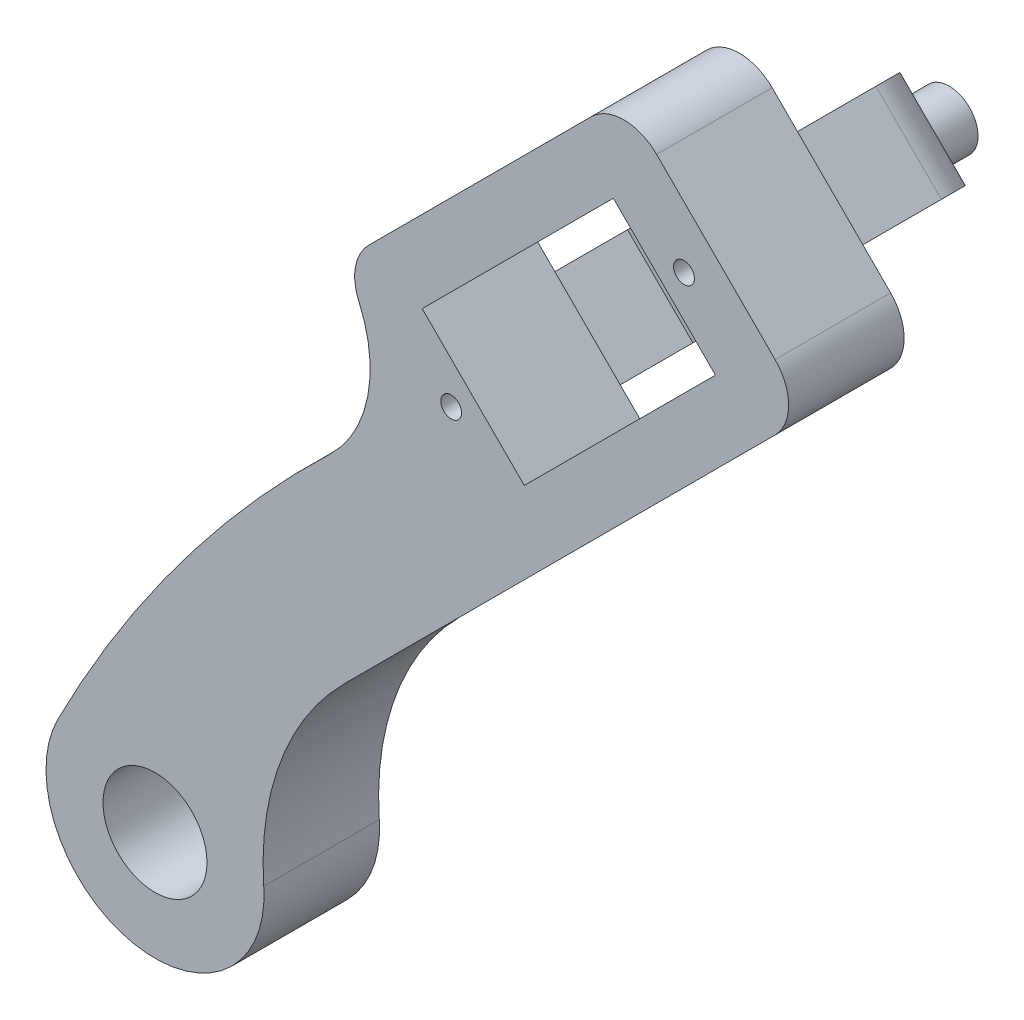
from build123d import *

# Parameters (mm, degrees)
SKETCH_2_R          = 4.5
EXTRUDE_1_DEPTH     = 10
EXTRUDE_2_DEPTH     = 4
SKETCH_5_R          = 3
EXTRUDE_3_DEPTH     = 2
SKETCH_6_R          = 0.9
CUT_EXTRUDE_1_DEPTH = 8
SKETCH_7_R          = 2.5
EXTRUDE_4_DEPTH     = 5


with BuildPart() as part:
    # 草图2 → 凸台-拉伸1 (new body)
    with BuildSketch(Plane.XY):
        with BuildLine():
            Line((7.102160211, -15.616687508), (44.391240582, 21.672392863))
            ThreePointArc((44.391240582, 21.672392863), (45.562813457, 24.500819988), (44.391240582, 27.329247112))
            Line((44.391240582, 27.329247112), (34.138192255, 37.58229544))
            ThreePointArc((34.138192255, 37.58229544), (31.30976513, 38.753868315), (28.481338005, 37.58229544))
            Line((28.481338005, 37.58229544), (9.215390399, 18.316347834))
            ThreePointArc((9.215390399, 18.316347834), (8.067593218, 16.131525495), (8.362136672, 13.681192624))
            ThreePointArc((8.362136672, 13.681192624), (9.134610316, 6.948541986), (5.886174479, 1.001024456))
            ThreePointArc((5.886174479, 1.001024456), (-7.225109998, -13.84439598), (-17.685225472, -30.663381468))
            ThreePointArc((-17.685225472, -30.663381468), (-11.168239652, -44.207967845), (0.129369861, -34.293788928))
            ThreePointArc((0.129369861, -34.293788928), (1.585802578, -24.197384934), (7.102160211, -15.616687508))
        make_face()
        with Locations((-9.283850525, -34.961173895)):
            Circle(SKETCH_2_R, mode=Mode.SUBTRACT)
        Polygon((39.229361079, 23.581581172), (22.6830624, 7.035282492), (13.844227635, 15.874117257), (30.390526315, 32.420415937), align=None, mode=Mode.SUBTRACT)
    extrude(amount=EXTRUDE_1_DEPTH)

    # 草图4 → 凸台-拉伸2 (add, symmetric)
    with BuildSketch(Plane(origin=(3.298406554, -3.298406554, 0), x_dir=(0, 0, -1), z_dir=(0.7071067811865492, -0.7071067811865458, 0))):
        with BuildLine():
            Line((0, 49.014043199), (0, 46.014043199))
            Line((0, 46.014043199), (7, 46.014043199))
            Line((7, 46.014043199), (7, 20.014043199))
            Line((7, 20.014043199), (0, 20.014043199))
            Line((0, 20.014043199), (0, 17.014043199))
            Line((0, 17.014043199), (8, 17.014043199))
            ThreePointArc((8, 17.014043199), (10.828427125, 18.185616074), (12, 21.014043199))
            Line((12, 21.014043199), (12, 45.014043199))
            ThreePointArc((12, 45.014043199), (10.828427125, 47.842470323), (8, 49.014043199))
            Line((8, 49.014043199), (0, 49.014043199))
        make_face()
    extrude(amount=EXTRUDE_2_DEPTH, both=True)

    # 草图5 → 凸台-拉伸3 (add)
    with BuildSketch(Plane(origin=(0, 0, -12), x_dir=(-1, 0, 0), z_dir=(0, 0, -1))):
        with Locations((-30.461236993, 23.864423885)):
            Circle(SKETCH_5_R)
    extrude(amount=EXTRUDE_3_DEPTH)

    # 草图6 → 切除-拉伸1 (cut)
    with BuildSketch(Plane.XY.offset(10)):
        with Locations((16.354456708, 9.7576436)):
            Circle(SKETCH_6_R)
        with Locations((36.506999972, 29.910186864)):
            Circle(SKETCH_6_R)
    extrude(amount=-CUT_EXTRUDE_1_DEPTH, mode=Mode.SUBTRACT)

    # 草图7 → 凸台-拉伸4 (add)
    with BuildSketch(Plane(origin=(0, 0, -14), x_dir=(-1, 0, 0), z_dir=(0, 0, -1))):
        with Locations((-30.461236993, 23.864423885)):
            Circle(SKETCH_7_R)
    extrude(amount=EXTRUDE_4_DEPTH)


solid = part.part
